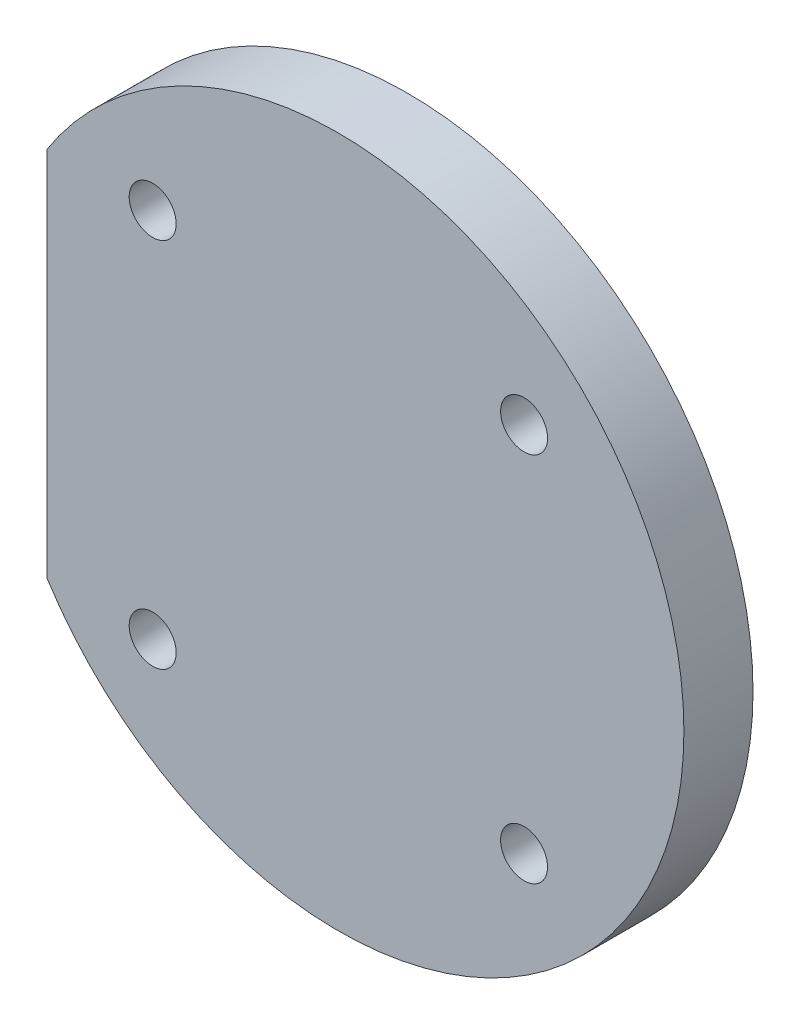
from build123d import *

# Parameters (mm, degrees)
BOSS_EXTRU_1_DEPTH      = 1
BOSS_EXTRU_1_DEPTH_BACK = 4
ESQUISSE1_R             = 25
ESQUISSE1_R_2           = 1.7
ESQUISSE2_W             = 7.120092975
ESQUISSE2_H             = 26.945103847
ENL_V_MAT_EXTRU_1_DEPTH = 36.707142143


with BuildPart() as part:
    # Esquisse1 → Boss.-Extru.1 (new, two sides: drawn at the far end of the back side and taken through both)
    with BuildSketch(Plane.XY.offset(-BOSS_EXTRU_1_DEPTH_BACK)):
        Circle(ESQUISSE1_R)
        with Locations((-13.435028843, 13.435028843)):
            Circle(ESQUISSE1_R_2, mode=Mode.SUBTRACT)
        with Locations((13.435028843, 13.435028843)):
            Circle(ESQUISSE1_R_2, mode=Mode.SUBTRACT)
        with Locations((13.435028843, -13.435028843)):
            Circle(ESQUISSE1_R_2, mode=Mode.SUBTRACT)
        with Locations((-13.435028843, -13.435028843)):
            Circle(ESQUISSE1_R_2, mode=Mode.SUBTRACT)
    extrude(amount=BOSS_EXTRU_1_DEPTH + BOSS_EXTRU_1_DEPTH_BACK)

    # Esquisse2 → Enlèv. mat.-Extru.1 (cut, through all)
    with BuildSketch(Plane(origin=(0, 0, -4), x_dir=(-1, 0, 0), z_dir=(0, 0, -1))):
        with Locations((24.643215129, 0.03752308)):
            Rectangle(ESQUISSE2_W, ESQUISSE2_H)
    extrude(amount=-ENL_V_MAT_EXTRU_1_DEPTH, mode=Mode.SUBTRACT)


solid = part.part
